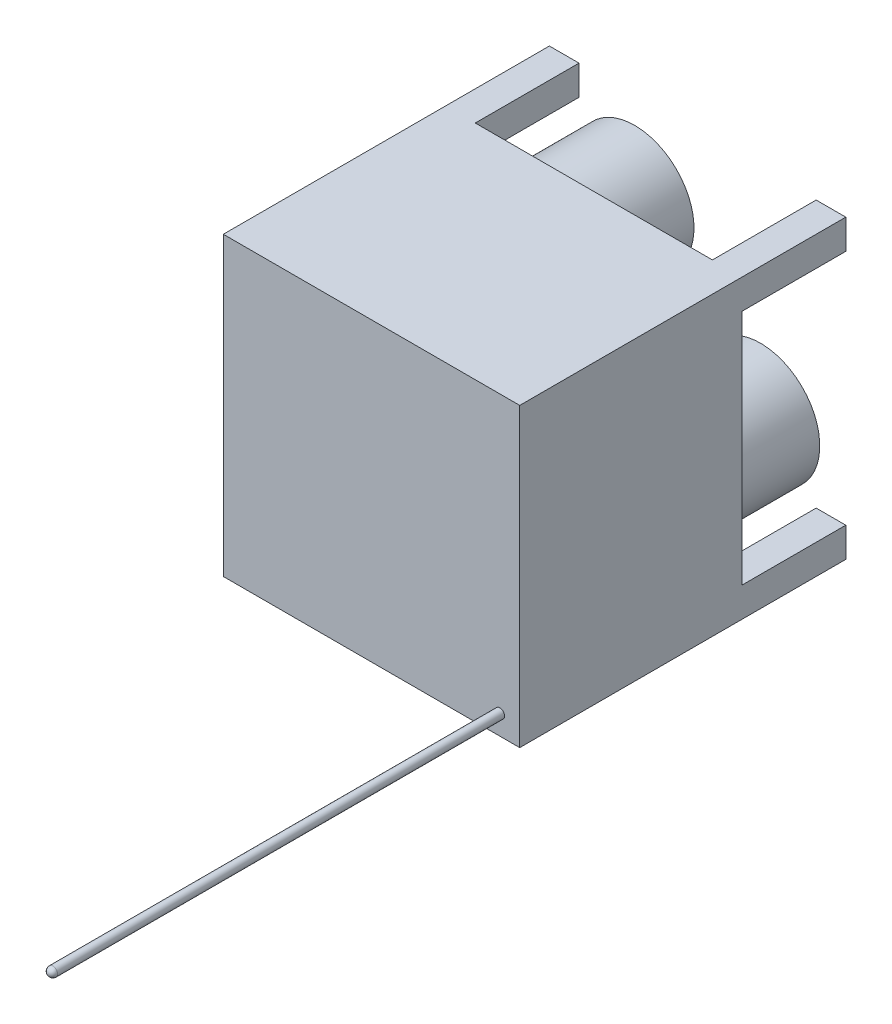
from build123d import *

# Parameters (mm, degrees)
SKETCH1_W           = 100
SKETCH1_H           = 100
BOSS_EXTRUDE1_DEPTH = 110
SKETCH2_R           = 1.5875
BOSS_EXTRUDE2_DEPTH = 152.4
FILLET1_R           = 1.5875
SKETCH4_W           = 10
SKETCH4_H           = 80
SKETCH4_W_2         = 80
SKETCH4_H_2         = 10
CUT_EXTRUDE2_DEPTH  = 35
SKETCH5_R           = 20
BOSS_EXTRUDE3_DEPTH = 35


with BuildPart() as part:
    # Sketch1 → Boss-Extrude1 (new body)
    with BuildSketch(Plane.XY):
        Rectangle(SKETCH1_W, SKETCH1_H)
    extrude(amount=BOSS_EXTRUDE1_DEPTH)

    # Sketch2 → Boss-Extrude2 (add)
    with BuildSketch(Plane.XY.offset(110)):
        with Locations(Location((43.298646859, -43.309895232, 0), (0, 0, 180))):
            Circle(SKETCH2_R)
    extrude(amount=BOSS_EXTRUDE2_DEPTH)

    # Fillet1
    fillet1_edges = [part.edges().sort_by_distance(p)[0] for p in [
        (44.886146859, -43.309895232, 262.4),
    ]]
    fillet(fillet1_edges, radius=FILLET1_R)

    # Sketch4 → Cut-Extrude2 (cut)
    with BuildSketch(Plane(origin=(0, 0, 0), x_dir=(-1, 0, 0), z_dir=(0, 0, -1))):
        with Locations((45, 0)):
            Rectangle(SKETCH4_W, SKETCH4_H)
        Rectangle(SKETCH4_W_2, SKETCH4_H)
        with Locations((-45, 0)):
            Rectangle(SKETCH4_W, SKETCH4_H)
        with Locations((0, -45)):
            Rectangle(SKETCH4_W_2, SKETCH4_H_2)
        with Locations((0, 45)):
            Rectangle(SKETCH4_W_2, SKETCH4_H_2)
    extrude(amount=-CUT_EXTRUDE2_DEPTH, mode=Mode.SUBTRACT)

    # Sketch5 → Boss-Extrude3 (add)
    with BuildSketch(Plane(origin=(0, 0, 35), x_dir=(-1, 0, 0), z_dir=(0, 0, -1))):
        with BuildLine():
            ThreePointArc((35.355339059, 35.355339059), (7.071067812, 35.355339059), (7.071067812, 7.071067812))
            Line((7.071067812, 7.071067812), (35.355339059, 35.355339059))
        make_face()
        with BuildLine():
            Line((35.355339059, 35.355339059), (7.071067812, 7.071067812))
            ThreePointArc((7.071067812, 7.071067812), (28.866872083, 2.735612785), (41.213203436, 21.213203436))
            ThreePointArc((41.213203436, 21.213203436), (39.690794086, 28.866872083), (35.355339059, 35.355339059))
        make_face()
        with Locations((-21.213203436, -21.213203436)):
            Circle(SKETCH5_R)
    extrude(amount=BOSS_EXTRUDE3_DEPTH)


solid = part.part
